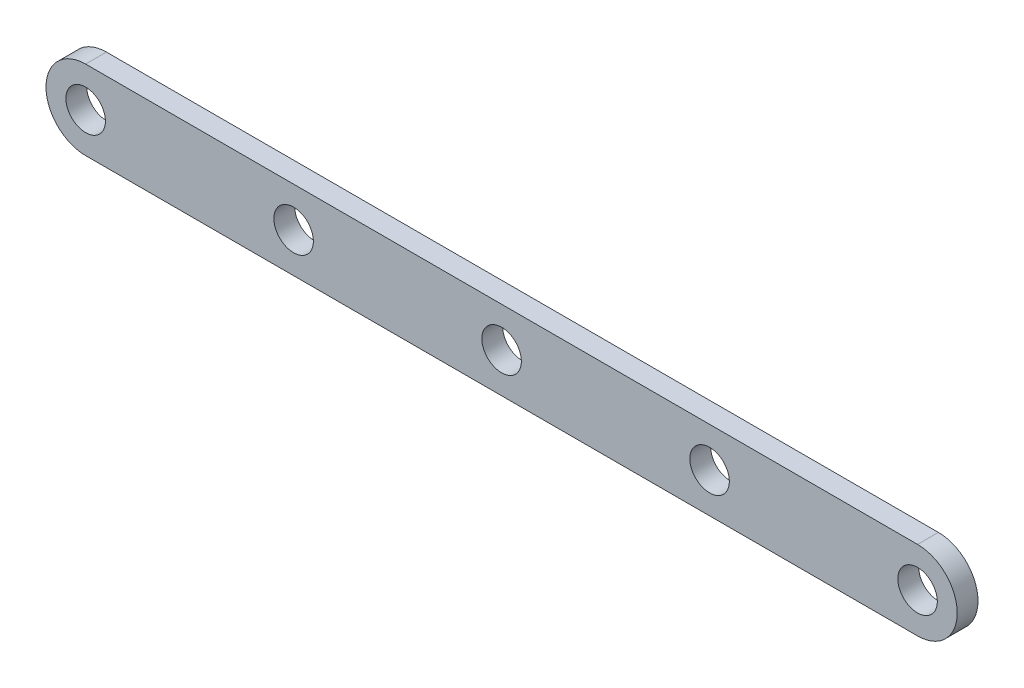
from build123d import *

# Parameters (mm, degrees)
SALIENTE_EXTRUIR3_DEPTH = 1.27
CROQUIS4_R              = 2.413
CORTAR_EXTRUIR2_DEPTH   = 82.225452068
MATRIZL3_COUNT          = 5
MATRIZL3_PITCH          = 25.4


with BuildPart() as part:
    # Croquis1 → Saliente-Extruir3 (new, symmetric)
    with BuildSketch(Plane.XY):
        with BuildLine():
            Line((76.2, -4.841253264), (-25.4, -4.841253264))
            ThreePointArc((-25.4, -4.841253264), (-30.241253264, 0), (-25.4, 4.841253264))
            Line((-25.4, 4.841253264), (76.2, 4.841253264))
            ThreePointArc((76.2, 4.841253264), (81.041253264, 0), (76.2, -4.841253264))
        make_face()
    extrude(amount=SALIENTE_EXTRUIR3_DEPTH, both=True)

    # Croquis4 → Cortar-Extruir2 (cut, through all)
    with BuildSketch(Plane.XY.offset(1.27)):
        with Locations((-25.4, 0)):
            Circle(CROQUIS4_R)
    cortar_extruir2 = extrude(amount=-CORTAR_EXTRUIR2_DEPTH, mode=Mode.SUBTRACT)

    # MatrizL3: Cortar-Extruir2 ×5
    with Locations(*[(i * MATRIZL3_PITCH, 0, 0) for i in range(1, MATRIZL3_COUNT)]):
        add(cortar_extruir2, mode=Mode.SUBTRACT)


solid = part.part
